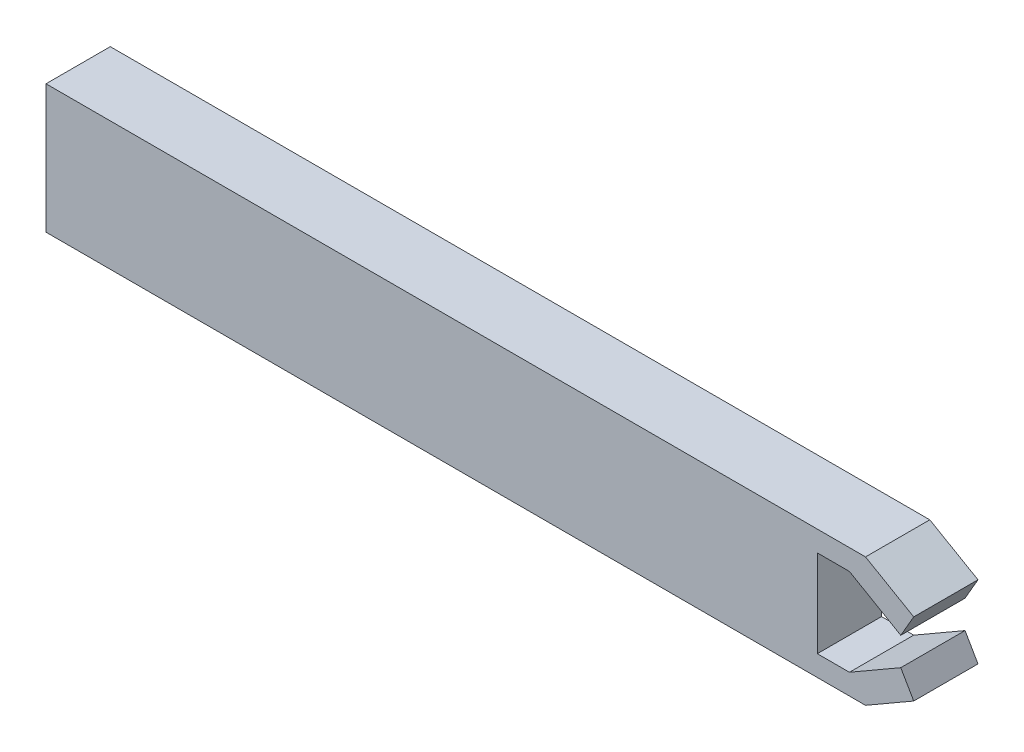
from build123d import *

# Parameters (mm, degrees)
BOSS_EXTRUDE1_DEPTH = 20


with BuildPart() as part:
    # Sketch1 → Boss-Extrude1 (new body)
    with BuildSketch(Plane.XY):
        Polygon((-15, 0), (-270, 0), (-270, 40), (-15, 40), (0, 31.339745962), (-4.028834937, 24.361599156), (-20, 33.582555605), (-30, 33.582555605), (-30, 6.417444395), (-20, 6.417444395), (-4.028834937, 15.638400844), (0, 8.660254038), align=None)
    extrude(amount=BOSS_EXTRUDE1_DEPTH)


solid = part.part
